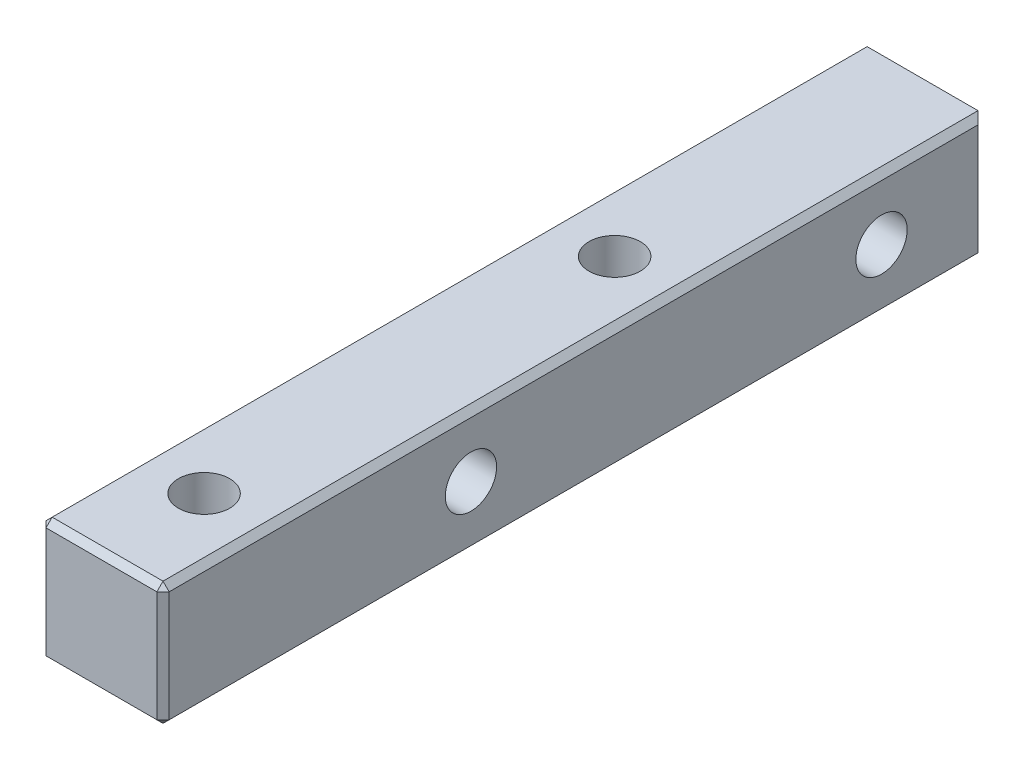
from build123d import *

# Parameters (mm, degrees)
SKETCH_1_W      = 6
SKETCH_1_H      = 6
EXTRUDE_1_DEPTH = 20
HOLE_WIZARD_1_D = 2.5
HOLE_WIZARD_2_D = 2.5
CHAMFER_1_SIZE  = 0.3


with BuildPart() as part:
    # 草图1 → 凸台-拉伸1 (new, symmetric)
    with BuildSketch(Plane.XY):
        Rectangle(SKETCH_1_W, SKETCH_1_H)
    extrude(amount=EXTRUDE_1_DEPTH, both=True)

    # Hole Wizard 1 (through all)
    with Locations(Plane.ZY.offset(3)):
        with Locations((-15, 0), (5, 0)):
            Hole(HOLE_WIZARD_1_D / 2)

    # Hole Wizard 2 (through all)
    with Locations(Plane(origin=(0, 3, 0), x_dir=(1, 0, 0), z_dir=(0, 1, 0))):
        with Locations((0, 5), (0, -15)):
            Hole(HOLE_WIZARD_2_D / 2)

    # 倒角1
    chamfer_1_edges = [part.edges().sort_by_distance(p)[0] for p in [
        (-3, 0, 20),
        (0, -3, 20),
        (3, 0, 20),
        (0, -3, -20),
        (-3, 0, -20),
        (3, 0, -20),
        (3, -3, 0),
        (-3, -3, 0),
        (-3, 3, 0),
        (3, 3, 0),
        (0, 3, 20),
    ]]
    chamfer(chamfer_1_edges, length=CHAMFER_1_SIZE)


solid = part.part
